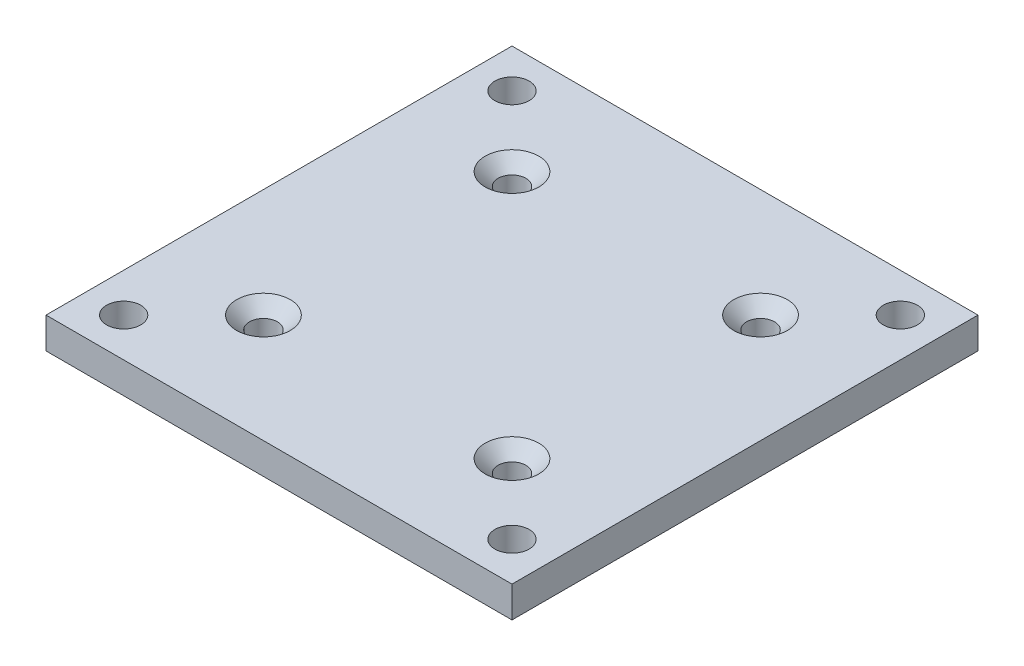
from build123d import *

# Parameters (mm, degrees)
SKETCH1_W                                       = 60
SKETCH1_H                                       = 60
SKETCH1_R                                       = 2.2
SKETCH1_R_2                                     = 1.65
BOSS_EXTRUDE1_DEPTH                             = 4
CSK_FOR_M3_FLAT_HEAD_MACHINE_SCREW1_D           = 3.6
CSK_FOR_M3_FLAT_HEAD_MACHINE_SCREW1_CSINK_D     = 6.9
CSK_FOR_M3_FLAT_HEAD_MACHINE_SCREW1_CSINK_ANGLE = 90


with BuildPart() as part:
    # Sketch1 → Boss-Extrude1 (new body)
    with BuildSketch(Plane(origin=(0, 0, 0), x_dir=(1, 0, 0), z_dir=(0, 1, 0))):
        Rectangle(SKETCH1_W, SKETCH1_H)
        with Locations(Location((-25, 25, 0), (0, 0, 270))):
            Circle(SKETCH1_R, mode=Mode.SUBTRACT)
        with Locations(Location((-16, 16, 0), (0, 0, 270))):
            Circle(SKETCH1_R_2, mode=Mode.SUBTRACT)
        with Locations(Location((-25, -25, 0), (0, 0, 270))):
            Circle(SKETCH1_R, mode=Mode.SUBTRACT)
        with Locations(Location((-16, -16, 0), (0, 0, 270))):
            Circle(SKETCH1_R_2, mode=Mode.SUBTRACT)
        with Locations(Location((25, -25, 0), (0, 0, 270))):
            Circle(SKETCH1_R, mode=Mode.SUBTRACT)
        with Locations(Location((16, -16, 0), (0, 0, 270))):
            Circle(SKETCH1_R_2, mode=Mode.SUBTRACT)
        with Locations(Location((25, 25, 0), (0, 0, 270))):
            Circle(SKETCH1_R, mode=Mode.SUBTRACT)
        with Locations(Location((16, 16, 0), (0, 0, 270))):
            Circle(SKETCH1_R_2, mode=Mode.SUBTRACT)
    extrude(amount=BOSS_EXTRUDE1_DEPTH)

    # CSK for M3 Flat Head Machine Screw1 (through all)
    with Locations(Plane(origin=(16, 4, -16), x_dir=(0, 0, 1), z_dir=(0, 1, 0))):
        with Locations((0, 0), (32, 0), (32, -32), (0, -32)):
            CounterSinkHole(CSK_FOR_M3_FLAT_HEAD_MACHINE_SCREW1_D / 2, CSK_FOR_M3_FLAT_HEAD_MACHINE_SCREW1_CSINK_D / 2, counter_sink_angle=CSK_FOR_M3_FLAT_HEAD_MACHINE_SCREW1_CSINK_ANGLE)


solid = part.part
